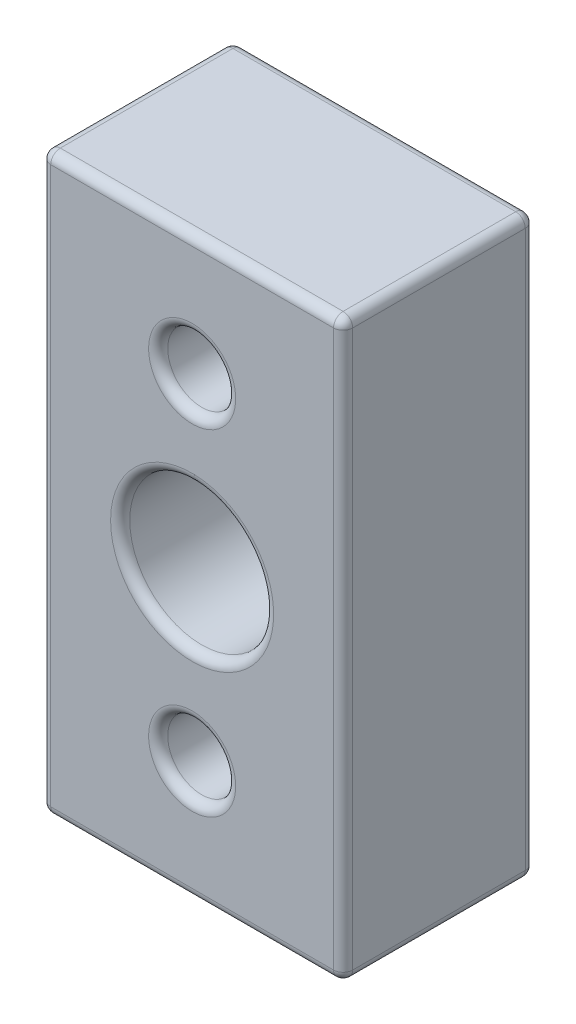
from build123d import *

# Parameters (mm, degrees)
SKETCH1_W           = 76.2
SKETCH1_H           = 40.005
BOSS_EXTRUDE1_DEPTH = 25.4
SKETCH2_R           = 9.53008
CUT_EXTRUDE1_DEPTH  = 50.96869026
SKETCH3_R           = 4.49961
CUT_EXTRUDE2_DEPTH  = 50.96869026
FILLET1_R           = 1.27


with BuildPart() as part:
    # Sketch1 → Boss-Extrude1 (new body)
    with BuildSketch(Plane(origin=(0, 0, 0), x_dir=(0, 1, 0), z_dir=(0, 0, 1))):
        Rectangle(SKETCH1_W, SKETCH1_H)
    extrude(amount=BOSS_EXTRUDE1_DEPTH)

    # Sketch2 → Cut-Extrude1 (cut, through all)
    with BuildSketch(Plane.XY.offset(25.4)):
        Circle(SKETCH2_R)
    extrude(amount=-CUT_EXTRUDE1_DEPTH, mode=Mode.SUBTRACT)

    # Sketch3 → Cut-Extrude2 (cut, through all)
    with BuildSketch(Plane.XY.offset(25.4)):
        with Locations((0, 22.225)):
            Circle(SKETCH3_R)
        with Locations((0, -22.225)):
            Circle(SKETCH3_R)
    extrude(amount=-CUT_EXTRUDE2_DEPTH, mode=Mode.SUBTRACT)

    # Fillet1
    fillet1_edges = [part.edges().sort_by_distance(p)[0] for p in [
        (0, -38.1, 25.4),
        (-9.53008, 0, 0),
        (-9.53008, 0, 25.4),
        (20.0025, 0, 25.4),
        (-4.49961, 22.225, 0),
        (-4.49961, 22.225, 25.4),
        (-4.49961, -22.225, 0),
        (-4.49961, -22.225, 25.4),
        (0, 38.1, 25.4),
        (20.0025, 0, 0),
        (0, -38.1, 0),
        (-20.0025, 0, 0),
        (0, 38.1, 0),
        (20.0025, 38.1, 12.7),
        (20.0025, -38.1, 12.7),
        (-20.0025, -38.1, 12.7),
        (-20.0025, 38.1, 12.7),
        (-20.0025, 0, 25.4),
    ]]
    fillet(fillet1_edges, radius=FILLET1_R)


solid = part.part
